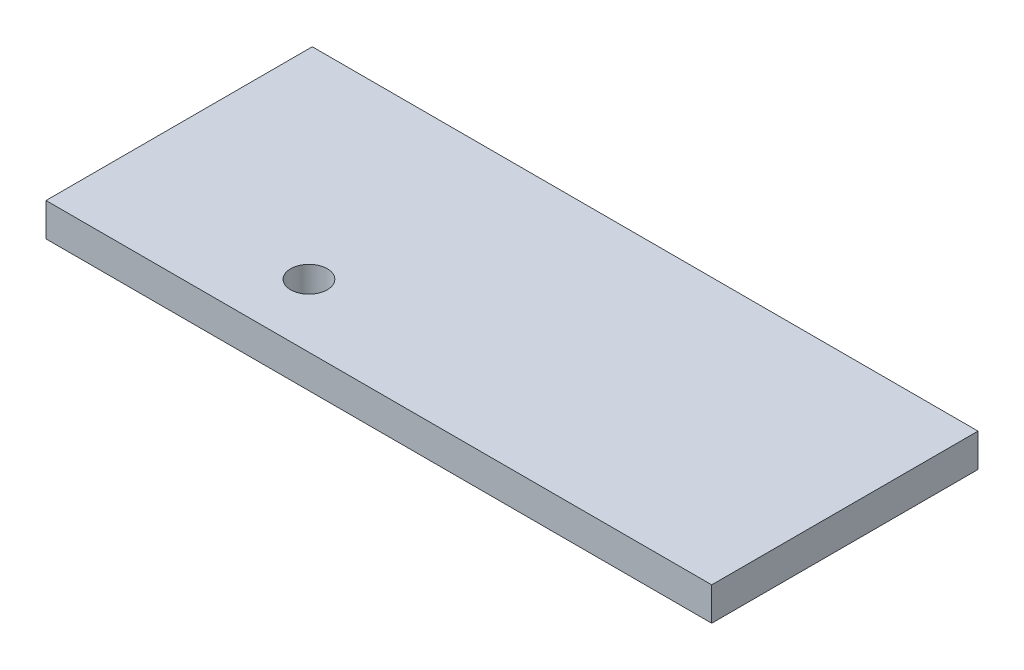
from build123d import *

# Parameters (mm, degrees)
SKETCH_1_W      = 400
SKETCH_1_H      = 160
SKETCH_1_R      = 11
EXTRUDE_1_DEPTH = 20


with BuildPart() as part:
    # 스케치1 → 보스-돌출1 (new body)
    with BuildSketch(Plane(origin=(0, 0, 0), x_dir=(1, 0, 0), z_dir=(0, 1, 0))):
        with Locations((200, 80)):
            Rectangle(SKETCH_1_W, SKETCH_1_H)
        with Locations(Location((120, 38, 0), (0, 0, 270))):
            Circle(SKETCH_1_R, mode=Mode.SUBTRACT)
    extrude(amount=EXTRUDE_1_DEPTH)


solid = part.part
